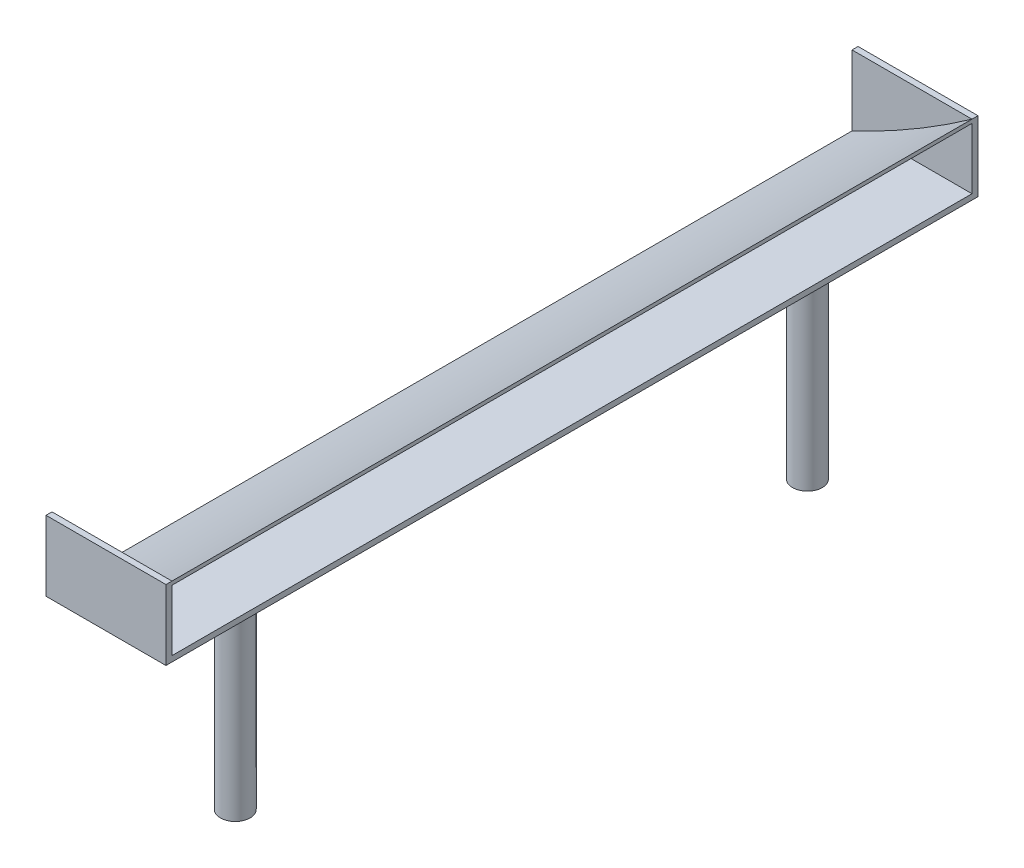
from build123d import *

# Parameters (mm, degrees)
BOSS_EXTRUDE1_DEPTH      = 672
BOSS_EXTRUDE1_DEPTH_BACK = 672
SKETCH2_W                = 200
SKETCH2_H                = 116.93693015
BOSS_EXTRUDE2_DEPTH      = 10
SKETCH3_W                = 166.612048155
SKETCH3_H                = 9.263959568
BOSS_EXTRUDE4_DEPTH      = 1344
SKETCH4_W                = 200
SKETCH4_H                = 116.93693015
BOSS_EXTRUDE5_DEPTH      = 10
SKETCH5_R                = 24.75
BOSS_EXTRUDE6_DEPTH      = 350


with BuildPart() as part:
    # Sketch1 → Boss-Extrude1 (new, two sides: drawn at the far end of the back side and taken through both)
    with BuildSketch(Plane.XY.offset(-BOSS_EXTRUDE1_DEPTH_BACK)):
        with BuildLine():
            Line((156.429158375, 112.402005818), (156.429158375, 106.3293088))
            add(Edge.make_bspline(
                [(-36.718341557, -4.534924332), (65.343074275, 41.2659049), (156.429158375, 106.3293088)],
                knots=[0, 0, 0, 1, 1, 1], degree=2))
            Line((-36.718341557, -4.534924332), (-43.570841625, -4.534924332))
            add(Edge.make_bspline(
                [(-43.570841625, -4.534924332), (61.566048456, 45.124972859), (156.429158375, 112.402005818)],
                knots=[0, 0, 0, 1, 1, 1], degree=2))
        make_face()
    extrude(amount=BOSS_EXTRUDE1_DEPTH + BOSS_EXTRUDE1_DEPTH_BACK)

    # Sketch2 → Boss-Extrude2 (add)
    with BuildSketch(Plane.XY.offset(672)):
        with Locations((56.429158375, 53.933540743)):
            Rectangle(SKETCH2_W, SKETCH2_H)
    extrude(amount=-BOSS_EXTRUDE2_DEPTH)

    # Sketch3 → Boss-Extrude4 (add)
    with BuildSketch(Plane(origin=(0, 0, 662), x_dir=(-1, 0, 0), z_dir=(0, 0, -1))):
        with Locations((-73.123134298, 0.097055452)):
            Rectangle(SKETCH3_W, SKETCH3_H)
    extrude(amount=BOSS_EXTRUDE4_DEPTH)

    # Sketch4 → Boss-Extrude5 (add)
    with BuildSketch(Plane(origin=(0, 0, -682), x_dir=(-1, 0, 0), z_dir=(0, 0, -1))):
        with Locations((-56.429158375, 53.933540743)):
            Rectangle(SKETCH4_W, SKETCH4_H)
    extrude(amount=-BOSS_EXTRUDE5_DEPTH)

    # Sketch5 → Boss-Extrude6 (add)
    with BuildSketch(Plane.XZ.offset(4.534924332)):
        with Locations((72.043158776, 472)):
            Circle(SKETCH5_R)
        with Locations((72.043158776, -482)):
            Circle(SKETCH5_R)
    extrude(amount=BOSS_EXTRUDE6_DEPTH)


solid = part.part
